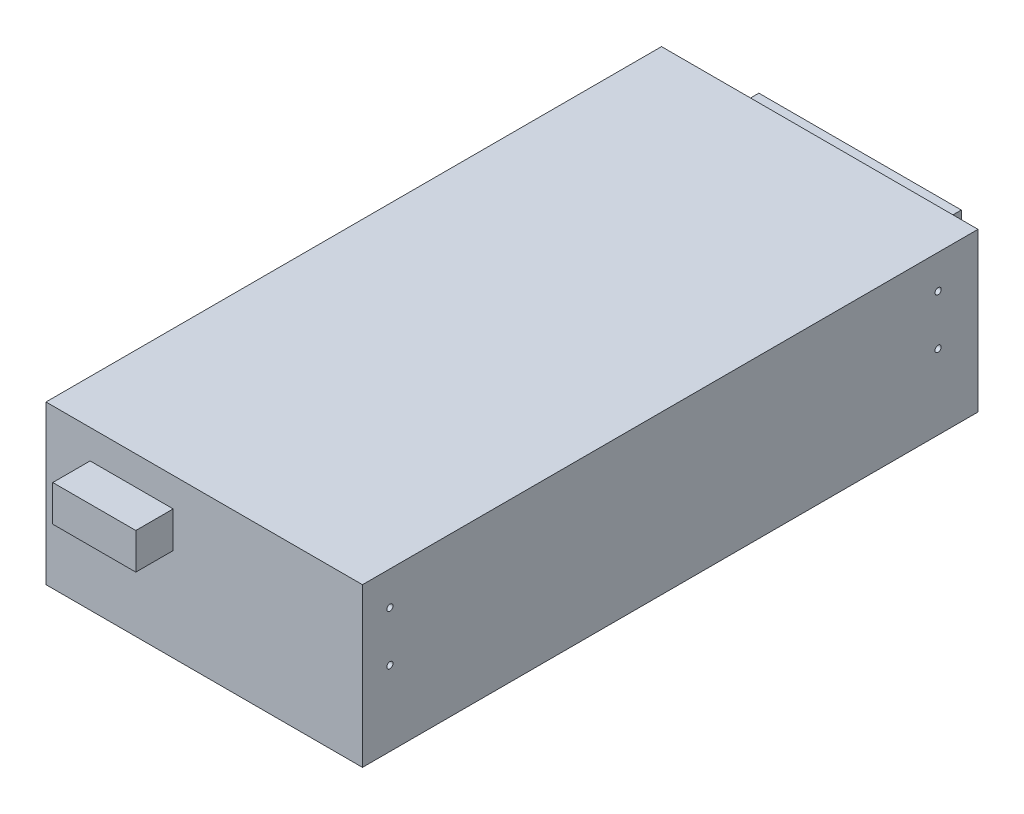
from build123d import *

# Parameters (mm, degrees)
SKETCH1_W                      = 127
SKETCH1_H                      = 247
BOSS_EXTRUDE1_DEPTH            = 63.5
M3X0_5_TAPPED_HOLE1_AT_2_COUNT = 2
M3X0_5_TAPPED_HOLE1_AT_2_PITCH = 220.907220344
M3X0_5_TAPPED_HOLE1_AT_3_COUNT = 2
M3X0_5_TAPPED_HOLE1_AT_3_PITCH = 20
M3X0_5_TAPPED_HOLE1_AT_4_COUNT = 2
M3X0_5_TAPPED_HOLE1_AT_4_PITCH = 220
SKETCH5_W                      = 33.332781188
SKETCH5_H                      = 14.481960758
BOSS_EXTRUDE2_DEPTH            = 15
SKETCH6_W                      = 81.228427944
SKETCH6_H                      = 10.113101088
BOSS_EXTRUDE3_DEPTH            = 17


with BuildPart() as part:
    # Sketch1 → Boss-Extrude1 (new body)
    with BuildSketch(Plane(origin=(0, 0, 0), x_dir=(1, 0, 0), z_dir=(0, 1, 0))):
        Rectangle(SKETCH1_W, SKETCH1_H)
    extrude(amount=BOSS_EXTRUDE1_DEPTH)

    # Sketch4 → M3x0.5 Tapped Hole1 (revolve, cut)
    with BuildSketch(Plane(origin=(63.5, 50, 112.5), x_dir=(0, 0, -1), z_dir=(0, 1, 0))):
        Polygon((0, 0), (0, 4.751075774), (1.25, 4), (1.25, 0), align=None)
    m3x0_5_tapped_hole1 = revolve(axis=Axis((69.85, 50, 112.5), (-1, 0, 0)), mode=Mode.SUBTRACT)

    # M3x0.5 Tapped Hole1 at 2: M3x0.5 Tapped Hole1 ×2
    with Locations(*[Vector(0, -0.09053574604251853, -0.9958932064677039) * (i * M3X0_5_TAPPED_HOLE1_AT_2_PITCH) for i in range(1, M3X0_5_TAPPED_HOLE1_AT_2_COUNT)]):
        add(m3x0_5_tapped_hole1, mode=Mode.SUBTRACT)

    # M3x0.5 Tapped Hole1 at 3: M3x0.5 Tapped Hole1 ×2
    with Locations(*[(0, -i * M3X0_5_TAPPED_HOLE1_AT_3_PITCH, 0) for i in range(1, M3X0_5_TAPPED_HOLE1_AT_3_COUNT)]):
        add(m3x0_5_tapped_hole1, mode=Mode.SUBTRACT)

    # M3x0.5 Tapped Hole1 at 4: M3x0.5 Tapped Hole1 ×2
    with Locations(*[(0, 0, -i * M3X0_5_TAPPED_HOLE1_AT_4_PITCH) for i in range(1, M3X0_5_TAPPED_HOLE1_AT_4_COUNT)]):
        add(m3x0_5_tapped_hole1, mode=Mode.SUBTRACT)

    # Sketch5 → Boss-Extrude2 (add)
    with BuildSketch(Plane.XY.offset(123.5)):
        with Locations((-29.125731135, 44.621088627)):
            Rectangle(SKETCH5_W, SKETCH5_H)
    extrude(amount=BOSS_EXTRUDE2_DEPTH)

    # Sketch6 → Boss-Extrude3 (add)
    with BuildSketch(Plane(origin=(0, 0, -123.5), x_dir=(-1, 0, 0), z_dir=(0, 0, -1))):
        with Locations((0.809048087, 44.806195806)):
            Rectangle(SKETCH6_W, SKETCH6_H)
    extrude(amount=BOSS_EXTRUDE3_DEPTH)

    # Mirror1: M3x0.5 Tapped Hole1 across plane
    add(m3x0_5_tapped_hole1.mirror(Plane(origin=(0, 0, 0), x_dir=(0, 0, 1), z_dir=(1, 0, 0))), mode=Mode.SUBTRACT)

    # Mirror1 copy 1 sketch → Mirror1 copy 1 (revolve, cut)
    with BuildSketch(Plane(origin=(-63.5, 30, -107.5), x_dir=(0, 0, -1), z_dir=(0, 1, 0))):
        Polygon((0, 0), (0, -4.751075774), (1.25, -4), (1.25, 0), align=None)
    revolve(axis=Axis((-69.85, 30, -107.5), (-1, 0, 0)), mode=Mode.SUBTRACT)

    # Mirror1 copy 2 sketch → Mirror1 copy 2 (revolve, cut)
    with BuildSketch(Plane(origin=(-63.5, 30, 112.5), x_dir=(0, 0, -1), z_dir=(0, 1, 0))):
        Polygon((0, 0), (0, -4.751075774), (1.25, -4), (1.25, 0), align=None)
    revolve(axis=Axis((-69.85, 30, 112.5), (-1, 0, 0)), mode=Mode.SUBTRACT)

    # Mirror1 copy 3 sketch → Mirror1 copy 3 (revolve, cut)
    with BuildSketch(Plane(origin=(-63.5, 50, -107.5), x_dir=(0, 0, -1), z_dir=(0, 1, 0))):
        Polygon((0, 0), (0, -4.751075774), (1.25, -4), (1.25, 0), align=None)
    revolve(axis=Axis((-69.85, 50, -107.5), (-1, 0, 0)), mode=Mode.SUBTRACT)


solid = part.part
